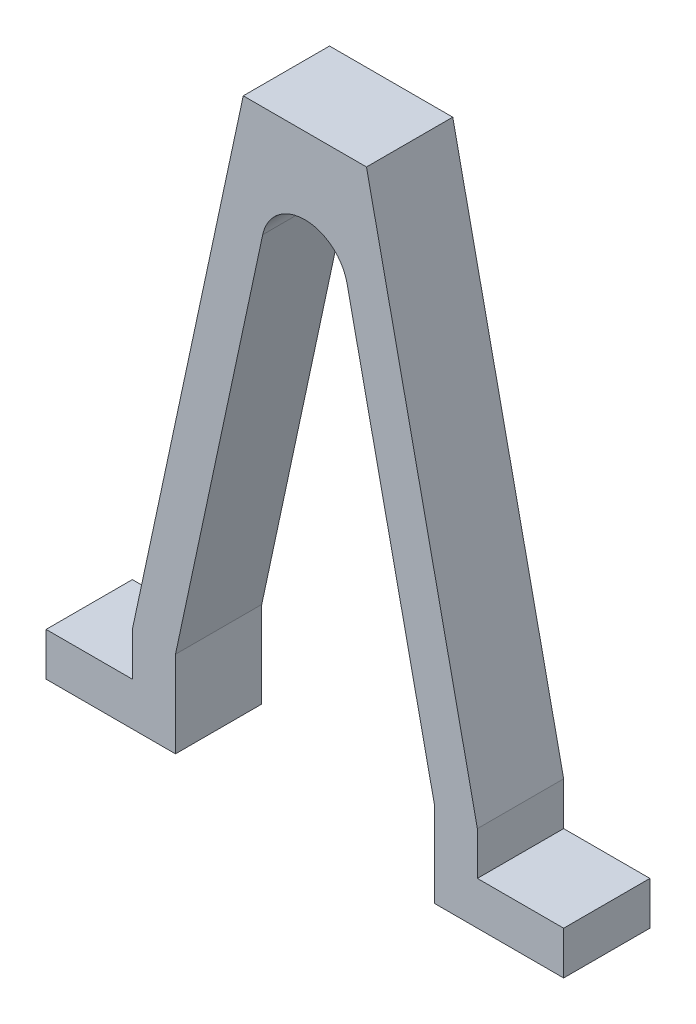
from build123d import *

# Parameters (mm, degrees)
BOSS_EXTRUDE1_DEPTH = 10
FILLET1_R           = 5
CUT_EXTRUDE1_DEPTH  = 10


with BuildPart() as part:
    # Sketch1 → Boss-Extrude1 (new body)
    with BuildSketch(Plane.XY):
        Polygon((0, 0), (15, 0), (15, 10), (30, 80), (45, 10), (45, 0), (60, 0), (60, 5), (50, 5), (50, 10), (30, 103.333333333), (10, 10), (10, 5), (0, 5), align=None)
    extrude(amount=BOSS_EXTRUDE1_DEPTH)

    # Fillet1
    fillet1_edges = [part.edges().sort_by_distance(p)[0] for p in [
        (30, 80, 5),
    ]]
    fillet(fillet1_edges, radius=FILLET1_R)

    # Sketch2 → Cut-Extrude1 (cut)
    with BuildSketch(Plane.XY.offset(10)):
        Polygon((17.180108491, 70), (46.95074544, 70), (40.829828982, 121.012949043), (-8.691955578, 121.012949043), align=None)
    extrude(amount=-CUT_EXTRUDE1_DEPTH, mode=Mode.SUBTRACT)


solid = part.part
